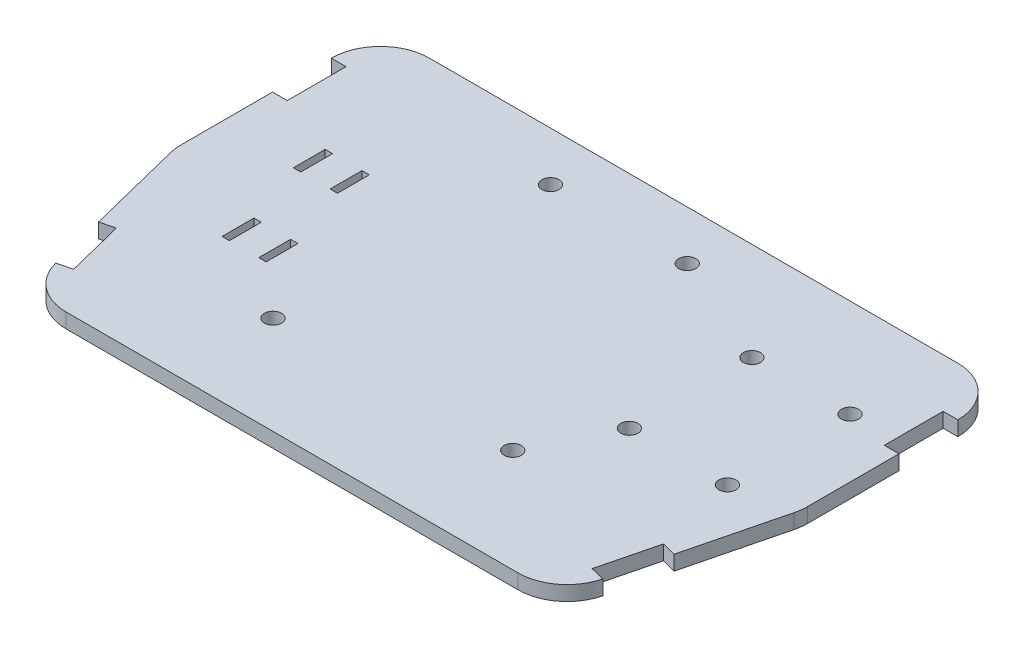
from build123d import *

# Parameters (mm, degrees)
BOSS_EXTRUDE1_DEPTH = 3
SKETCH1_3_R         = 3
BOSS_EXTRUDE2_DEPTH = 3
SKETCH3_R           = 1.75
CUT_EXTRUDE1_DEPTH  = 77.132204093
FILLET1_R           = 10
SKETCH4_R           = 1.75
CUT_EXTRUDE2_DEPTH  = 77.132204093
SKETCH5_W           = 1.5
SKETCH5_H           = 6.5
CUT_EXTRUDE3_DEPTH  = 77.132204093
LPATTERN1_COUNT     = 2
LPATTERN1_PITCH     = 20
SKETCH6_W           = 3
SKETCH6_H           = 12
CUT_EXTRUDE4_DEPTH  = 77.132204093


with BuildPart() as part:
    # Sketch1 → Boss-Extrude1 (new body)
    with BuildSketch(Plane(origin=(0, 0, 0), x_dir=(1, 0, 0), z_dir=(0, 1, 0))):
        Polygon((-63.9, -0.95), (-53.9, -40.95), (53.9, -40.95), (63.9, -0.95), (63.9, 40.95), (-63.9, 40.95), align=None)
    extrude(amount=BOSS_EXTRUDE1_DEPTH)

    # Sketch1<3> → Boss-Extrude2 (add)
    with BuildSketch(Plane(origin=(0, 0, 0), x_dir=(1, 0, 0), z_dir=(0, 1, 0))):
        with Locations((-19.2, 30.95)):
            Circle(SKETCH1_3_R)
        with Locations((8.7, 30.95)):
            Circle(SKETCH1_3_R)
        with Locations((-23.9, -20.95)):
            Circle(SKETCH1_3_R)
        with Locations((23.9, -19.85)):
            Circle(SKETCH1_3_R)
    extrude(amount=-BOSS_EXTRUDE2_DEPTH)

    # Sketch3 → Cut-Extrude1 (cut, through all)
    with BuildSketch(Plane.XZ.offset(3)):
        with Locations((-23.9, 20.95)):
            Circle(SKETCH3_R)
        with Locations((23.9, 19.85)):
            Circle(SKETCH3_R)
        with Locations((8.7, -30.95)):
            Circle(SKETCH3_R)
        with Locations((-19.2, -30.95)):
            Circle(SKETCH3_R)
    extrude(amount=-CUT_EXTRUDE1_DEPTH, mode=Mode.SUBTRACT)

    # Fillet1
    fillet1_edges = [part.edges().sort_by_distance(p)[0] for p in [
        (-63.9, 1.5, -40.95),
        (63.9, 1.5, -40.95),
        (63.9, 1.5, 0.95),
        (53.9, 1.5, 40.95),
        (-63.9, 1.5, 0.95),
        (-53.9, 1.5, 40.95),
    ]]
    fillet(fillet1_edges, radius=FILLET1_R)

    # Sketch4 → Cut-Extrude2 (cut, through all)
    with BuildSketch(Plane(origin=(0, 3, 0), x_dir=(1, 0, 0), z_dir=(0, 1, 0))):
        with Locations((51.9, 20.95)):
            Circle(SKETCH4_R)
        with Locations((31.9, 20.95)):
            Circle(SKETCH4_R)
        with Locations((51.9, -4.05)):
            Circle(SKETCH4_R)
        with Locations((31.9, -4.05)):
            Circle(SKETCH4_R)
    extrude(amount=-CUT_EXTRUDE2_DEPTH, mode=Mode.SUBTRACT)

    # Sketch5 → Cut-Extrude3 (cut, through all)
    with BuildSketch(Plane(origin=(0, 3, 0), x_dir=(1, 0, 0), z_dir=(0, 1, 0))):
        with Locations((-47.65, 10.95)):
            Rectangle(SKETCH5_W, SKETCH5_H)
        with Locations((-40.15, 10.95)):
            Rectangle(SKETCH5_W, SKETCH5_H)
    cut_extrude3 = extrude(amount=-CUT_EXTRUDE3_DEPTH, mode=Mode.SUBTRACT)

    # LPattern1: Cut-Extrude3 ×2
    with Locations(*[Vector(0.24253562503633305, 0, 0.9701425001453319) * (i * LPATTERN1_PITCH) for i in range(1, LPATTERN1_COUNT)]):
        add(cut_extrude3, mode=Mode.SUBTRACT)

    # Sketch6 → Cut-Extrude4 (cut, through all)
    with BuildSketch(Plane(origin=(0, 3, 0), x_dir=(1, 0, 0), z_dir=(0, 1, 0))):
        Polygon((58.704088438, -21.733646249), (55.793660937, -21.006039374), (52.883233437, -32.647749375), (55.793660937, -33.37535625), align=None)
        with Locations((-62.4, 24.95)):
            Rectangle(SKETCH6_W, SKETCH6_H)
        Polygon((-58.704088438, -21.733646249), (-55.793660937, -21.006039374), (-52.883233437, -32.647749375), (-55.793660937, -33.37535625), align=None)
        with Locations((62.4, 24.95)):
            Rectangle(SKETCH6_W, SKETCH6_H)
    extrude(amount=-CUT_EXTRUDE4_DEPTH, mode=Mode.SUBTRACT)


solid = part.part
